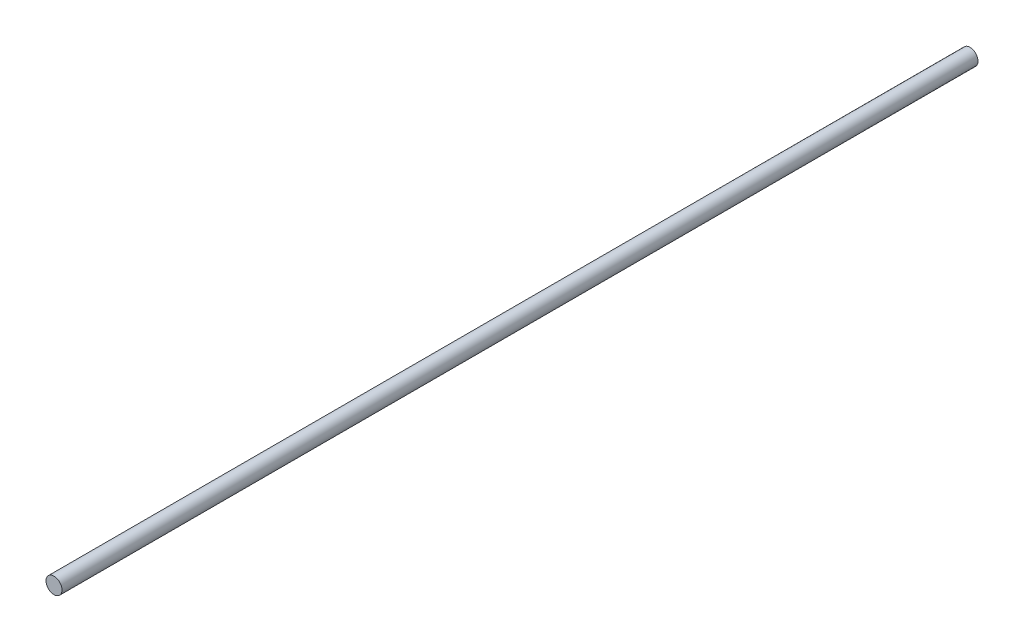
from build123d import *

# Parameters (mm, degrees)
SKETCH1_R           = 0.875
BOSS_EXTRUDE1_DEPTH = 100


with BuildPart() as part:
    # Sketch1 → Boss-Extrude1 (new body)
    with BuildSketch(Plane.XY):
        Circle(SKETCH1_R)
    extrude(amount=BOSS_EXTRUDE1_DEPTH)


solid = part.part
